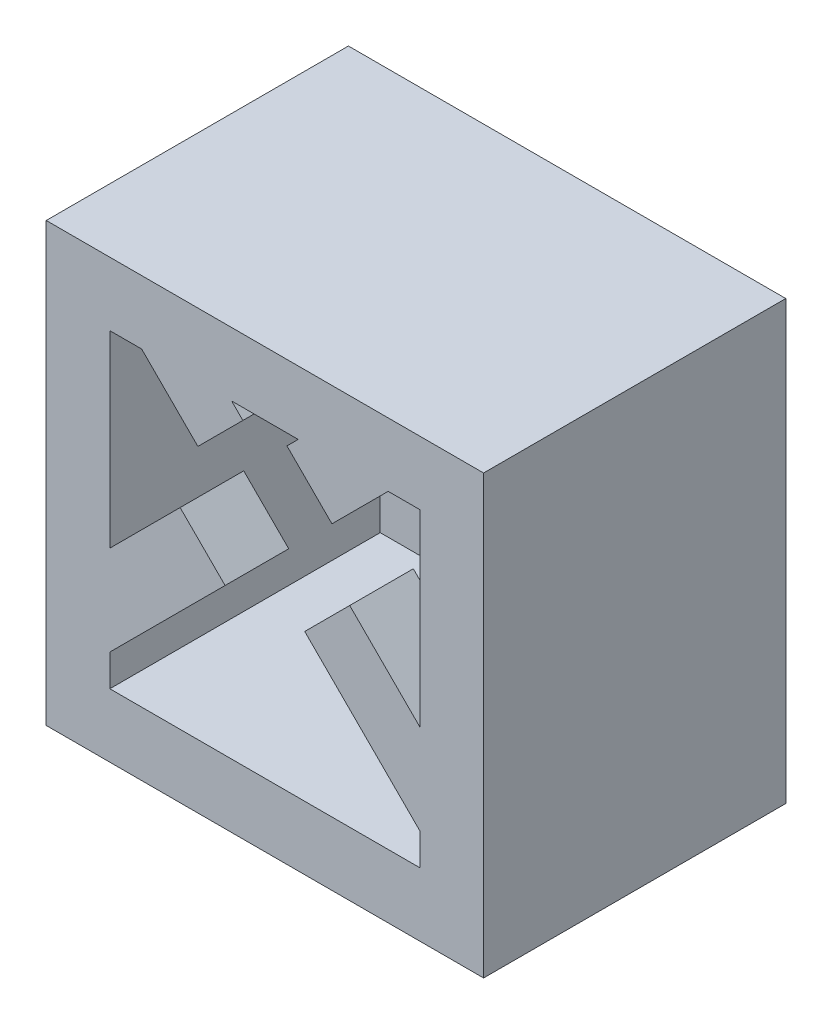
from build123d import *

# Parameters (mm, degrees)
SKETCH1_W               = 13.75
SKETCH1_H               = 13.75
BASEBOSS_EXTRUDE1_DEPTH = 1
WALLSSKETCH2_W          = 13.75
WALLSSKETCH2_H          = 13.75
WALLSSKETCH2_W_2        = 9.75
WALLSSKETCH2_H_2        = 9.75
BOSS_EXTRUDE2_DEPTH     = 6.5
SKETCH3_W               = 13.75
SKETCH3_H               = 13.75
BOSS_EXTRUDE3_DEPTH     = 2


with BuildPart() as part:
    # Sketch1 → BaseBoss-Extrude1 (new body)
    with BuildSketch(Plane.XY):
        with Locations((6.875, 6.875)):
            Rectangle(SKETCH1_W, SKETCH1_H)
    extrude(amount=BASEBOSS_EXTRUDE1_DEPTH)

    # WallsSketch2 → Boss-Extrude2 (add)
    with BuildSketch(Plane.XY.offset(1)):
        with Locations((6.875, 6.875)):
            Rectangle(WALLSSKETCH2_W, WALLSSKETCH2_H)
        with Locations((6.875, 6.875)):
            Rectangle(WALLSSKETCH2_W_2, WALLSSKETCH2_H_2, mode=Mode.SUBTRACT)
    extrude(amount=BOSS_EXTRUDE2_DEPTH)

    # Sketch3 → Boss-Extrude3 (add)
    with BuildSketch(Plane.XY.offset(7.5)):
        with Locations((6.875, 6.875)):
            Rectangle(SKETCH3_W, SKETCH3_H)
        Polygon((2, 3), (5.623475836, 6.623475836), (4.209262274, 8.037689399), (2, 5.828427125), (2, 11.75), (3, 11.75), (4.767766953, 9.982233047), (6.181980515, 11.396446609), (5.828427125, 11.75), (7.921572875, 11.75), (7.568019485, 11.396446609), (8.982233047, 9.982233047), (10.75, 11.75), (11.75, 11.75), (11.75, 5.828427125), (9.540737726, 8.037689399), (8.126524164, 6.623475836), (11.75, 3), (11.75, 2), (2, 2), align=None, mode=Mode.SUBTRACT)
    extrude(amount=BOSS_EXTRUDE3_DEPTH)


solid = part.part
